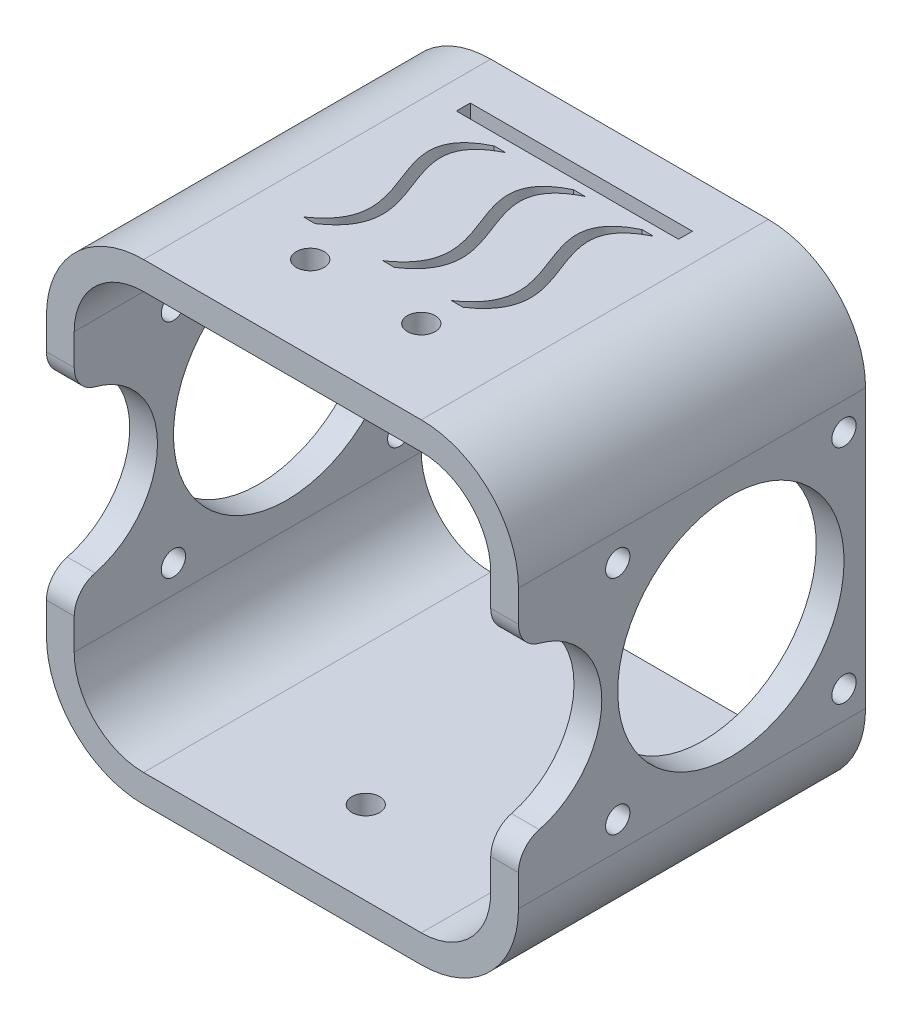
from build123d import *

# Parameters (mm, degrees)
ESTRUSIONE_SOTTILE1_DEPTH = 50
SCHIZZO2_R                = 2
TAGLIO_ESTRUSIONE1_DEPTH  = 10
SCHIZZO3_R                = 12
TAGLIO_ESTRUSIONE2_DEPTH  = 68
RACCORDO1_R               = 4
RACCORDO2_R               = 4
RACCORDO3_R               = 4
RACCORDO4_R               = 4
SCHIZZO4_R                = 2
TAGLIO_ESTRUSIONE3_DEPTH  = 10
SCHIZZO5_W                = 32
SCHIZZO5_H                = 2
TAGLIO_ESTRUSIONE4_DEPTH  = 10
TAGLIO_ESTRUSIONE6_REACH  = 107.925
SCHIZZO8_R                = 16.3
TAGLIO_ESTRUSIONE5_REACH  = 107.925
SCHIZZO7_R                = 1.75


with BuildPart() as part:
    # Schizzo1 → Estrusione-Sottile1 (new body)
    with BuildSketch(Plane.XY):
        with BuildLine():
            Line((-64, -10), (-64, -50))
            ThreePointArc((-64, -50), (-59.899494937, -59.899494937), (-50, -64))
            Line((-50, -64), (-10, -64))
            ThreePointArc((-10, -64), (-0.100505063, -59.899494937), (4, -50))
            Line((4, -50), (4, -10))
            ThreePointArc((4, -10), (-0.100505063, -0.100505063), (-10, 4))
            Line((-10, 4), (-50, 4))
            ThreePointArc((-50, 4), (-59.899494937, -0.100505063), (-64, -10))
        make_face()
        with BuildLine():
            Line((-60, -10), (-60, -50))
            ThreePointArc((-60, -50), (-57.071067812, -57.071067812), (-50, -60))
            Line((-50, -60), (-10, -60))
            ThreePointArc((-10, -60), (-2.928932188, -57.071067812), (0, -50))
            Line((0, -50), (0, -10))
            ThreePointArc((0, -10), (-2.928932188, -2.928932188), (-10, 0))
            Line((-10, 0), (-50, 0))
            ThreePointArc((-50, 0), (-57.071067812, -2.928932188), (-60, -10))
        make_face(mode=Mode.SUBTRACT)
    extrude(amount=ESTRUSIONE_SOTTILE1_DEPTH)

    # Schizzo2 → Taglio-Estrusione1 (cut)
    with BuildSketch(Plane(origin=(0, 4, 0), x_dir=(1, 0, 0), z_dir=(0, 1, 0))):
        with Locations(Location((-38, -38, 0), (0, 0, 180))):
            Circle(SCHIZZO2_R)
        with Locations(Location((-22, -38, 0), (0, 0, 180))):
            Circle(SCHIZZO2_R)
    extrude(amount=-TAGLIO_ESTRUSIONE1_DEPTH, mode=Mode.SUBTRACT)

    # Schizzo3 → Taglio-Estrusione2 (cut)
    with BuildSketch(Plane.ZY.offset(64)):
        with Locations((50, -30)):
            Circle(SCHIZZO3_R)
    extrude(amount=-TAGLIO_ESTRUSIONE2_DEPTH, mode=Mode.SUBTRACT)

    # Raccordo1
    raccordo1_edges = [part.edges().sort_by_distance(p)[0] for p in [
        (-62, -18, 50),
    ]]
    fillet(raccordo1_edges, radius=RACCORDO1_R)

    # Raccordo2
    raccordo2_edges = [part.edges().sort_by_distance(p)[0] for p in [
        (-62, -42, 50),
    ]]
    fillet(raccordo2_edges, radius=RACCORDO2_R)

    # Raccordo3
    raccordo3_edges = [part.edges().sort_by_distance(p)[0] for p in [
        (2, -18, 50),
    ]]
    fillet(raccordo3_edges, radius=RACCORDO3_R)

    # Raccordo4
    raccordo4_edges = [part.edges().sort_by_distance(p)[0] for p in [
        (2, -42, 50),
    ]]
    fillet(raccordo4_edges, radius=RACCORDO4_R)

    # Schizzo4 → Taglio-Estrusione3 (cut)
    with BuildSketch(Plane.XZ.offset(64)):
        with Locations((-30, 38)):
            Circle(SCHIZZO4_R)
    extrude(amount=-TAGLIO_ESTRUSIONE3_DEPTH, mode=Mode.SUBTRACT)

    # Schizzo5 → Taglio-Estrusione4 (cut)
    with BuildSketch(Plane(origin=(0, 4, 0), x_dir=(1, 0, 0), z_dir=(0, 1, 0))):
        with Locations((-30, -7.945849316)):
            Rectangle(SCHIZZO5_W, SCHIZZO5_H)
        with BuildLine():
            Line((-30.960454742, -32.928721256), (-32.639127219, -32.919533938))
            add(Edge.make_bspline(
                [(-27.742758505, -10.323050859), (-39.164938897, -15.912155443), (-21.882006837, -25.659406976), (-32.639127219, -32.919533938)],
                knots=[0, 0, 0, 0, 1, 1, 1, 1], degree=3))
            Line((-27.742758505, -10.323050859), (-26.064086029, -10.332238178))
            add(Edge.make_bspline(
                [(-26.064086029, -10.332238178), (-37.486266421, -15.921342761), (-20.203334361, -25.668594294), (-30.960454742, -32.928721256)],
                knots=[0, 0, 0, 0, 1, 1, 1, 1], degree=3))
        make_face()
        with BuildLine():
            Line((-42.135720019, -33.181656302), (-43.814392495, -33.172468983))
            add(Edge.make_bspline(
                [(-38.918023781, -10.575985905), (-50.340204173, -16.165090488), (-33.057272113, -25.912342021), (-43.814392495, -33.172468983)],
                knots=[0, 0, 0, 0, 1, 1, 1, 1], degree=3))
            Line((-38.918023781, -10.575985905), (-37.239351305, -10.585173223))
            add(Edge.make_bspline(
                [(-37.239351305, -10.585173223), (-48.661531697, -16.174277806), (-31.378599637, -25.921529339), (-42.135720019, -33.181656302)],
                knots=[0, 0, 0, 0, 1, 1, 1, 1], degree=3))
        make_face()
        with BuildLine():
            Line((-21.047266541, -32.963061307), (-22.725939017, -32.953873989))
            add(Edge.make_bspline(
                [(-17.829570303, -10.35739091), (-29.251750695, -15.946495494), (-11.968818635, -25.693747027), (-22.725939017, -32.953873989)],
                knots=[0, 0, 0, 0, 1, 1, 1, 1], degree=3))
            Line((-17.829570303, -10.35739091), (-16.150897827, -10.366578228))
            add(Edge.make_bspline(
                [(-16.150897827, -10.366578228), (-27.573078219, -15.955682812), (-10.290146159, -25.702934345), (-21.047266541, -32.963061307)],
                knots=[0, 0, 0, 0, 1, 1, 1, 1], degree=3))
        make_face()
    extrude(amount=-TAGLIO_ESTRUSIONE4_DEPTH, mode=Mode.SUBTRACT)

    # Taglio-Estrusione6: up to this face of the body (flat: up to its plane)
    taglio_estrusione6_end = Plane(part.part.faces().sort_by_distance((4, -30, 22.393243333))[0])
    # Schizzo8 → Taglio-Estrusione6 (cut, up to the picked face)
    with BuildSketch(Plane.ZY.offset(64), mode=Mode.PRIVATE) as taglio_estrusione6_sk1:
        with Locations(Location((19.401575039, -30.040864416, 0), (0, 0, 270))):
            Circle(SCHIZZO8_R)
    taglio_estrusione6_tool1 = split(extrude(taglio_estrusione6_sk1.sketch, amount=-TAGLIO_ESTRUSIONE6_REACH, mode=Mode.PRIVATE), bisect_by=taglio_estrusione6_end, keep=Keep.BOTH, mode=Mode.PRIVATE)
    add(taglio_estrusione6_tool1.solids().sort_by(Axis((-64, -30.040864, 19.401575), (1, 0, 0)))[0], mode=Mode.SUBTRACT)

    # Taglio-Estrusione5: up to this face of the body (flat: up to its plane)
    taglio_estrusione5_end = Plane(part.part.faces().sort_by_distance((4, -30, 37.359687576))[0])
    # Schizzo7 → Taglio-Estrusione5 (cut, up to the picked face)
    with BuildSketch(Plane.ZY.offset(64), mode=Mode.PRIVATE) as taglio_estrusione5_sk1:
        with Locations(Location((35.701575039, -14, 0), (0, 0, 270))):
            Circle(SCHIZZO7_R)
    taglio_estrusione5_tool1 = split(extrude(taglio_estrusione5_sk1.sketch, amount=-TAGLIO_ESTRUSIONE5_REACH, mode=Mode.PRIVATE), bisect_by=taglio_estrusione5_end, keep=Keep.BOTH, mode=Mode.PRIVATE)
    # Schizzo7 → Taglio-Estrusione5 (cut, up to the picked face)
    with BuildSketch(Plane.ZY.offset(64), mode=Mode.PRIVATE) as taglio_estrusione5_sk2:
        with Locations(Location((35.701575039, -46, 0), (0, 0, 90))):
            Circle(SCHIZZO7_R)
    taglio_estrusione5_tool2 = split(extrude(taglio_estrusione5_sk2.sketch, amount=-TAGLIO_ESTRUSIONE5_REACH, mode=Mode.PRIVATE), bisect_by=taglio_estrusione5_end, keep=Keep.BOTH, mode=Mode.PRIVATE)
    # Schizzo7 → Taglio-Estrusione5 (cut, up to the picked face)
    with BuildSketch(Plane.ZY.offset(64), mode=Mode.PRIVATE) as taglio_estrusione5_sk3:
        with Locations(Location((3.101575039, -46, 0), (0, 0, 270))):
            Circle(SCHIZZO7_R)
    taglio_estrusione5_tool3 = split(extrude(taglio_estrusione5_sk3.sketch, amount=-TAGLIO_ESTRUSIONE5_REACH, mode=Mode.PRIVATE), bisect_by=taglio_estrusione5_end, keep=Keep.BOTH, mode=Mode.PRIVATE)
    # Schizzo7 → Taglio-Estrusione5 (cut, up to the picked face)
    with BuildSketch(Plane.ZY.offset(64), mode=Mode.PRIVATE) as taglio_estrusione5_sk4:
        with Locations(Location((3.101575039, -14, 0), (0, 0, 90))):
            Circle(SCHIZZO7_R)
    taglio_estrusione5_tool4 = split(extrude(taglio_estrusione5_sk4.sketch, amount=-TAGLIO_ESTRUSIONE5_REACH, mode=Mode.PRIVATE), bisect_by=taglio_estrusione5_end, keep=Keep.BOTH, mode=Mode.PRIVATE)
    add(taglio_estrusione5_tool1.solids().sort_by(Axis((-64, -14, 35.701575), (1, 0, 0)))[0], mode=Mode.SUBTRACT)
    add(taglio_estrusione5_tool2.solids().sort_by(Axis((-64, -46, 35.701575), (1, 0, 0)))[0], mode=Mode.SUBTRACT)
    add(taglio_estrusione5_tool3.solids().sort_by(Axis((-64, -46, 3.101575), (1, 0, 0)))[0], mode=Mode.SUBTRACT)
    add(taglio_estrusione5_tool4.solids().sort_by(Axis((-64, -14, 3.101575), (1, 0, 0)))[0], mode=Mode.SUBTRACT)


solid = part.part
